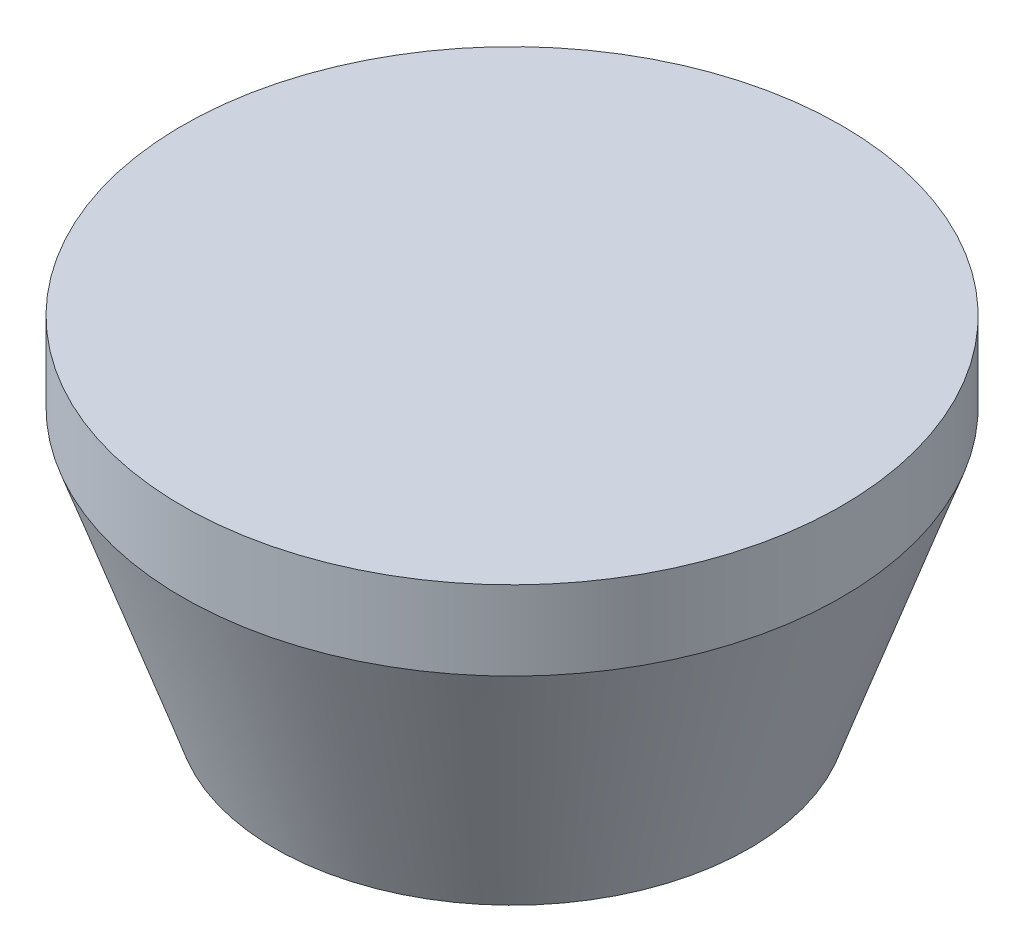
from build123d import *


with BuildPart() as part:
    # Sketch1 → Revolve1 (revolve)
    with BuildSketch(Plane.XY, mode=Mode.PRIVATE) as revolve1_sk:
        with BuildLine():
            Line((0, 0), (12.5, 0))
            Line((12.5, 0), (12.5, -3))
            Line((12.5, -3), (9, -13))
            Line((9, -13), (5.656854249, -13))
            ThreePointArc((5.656854249, -13), (4.840357669, -12.577350269), (4.714045208, -11.666666667))
            ThreePointArc((4.714045208, -11.666666667), (4.082482905, -7.113248654), (0, -5))
            Line((0, -5), (0, 0))
        make_face()
    revolve(revolve1_sk.sketch.rotate(Axis((0, -5, 0), (0, 1, 0)), 90), axis=Axis((0, -5, 0), (0, 1, 0)))


solid = part.part
